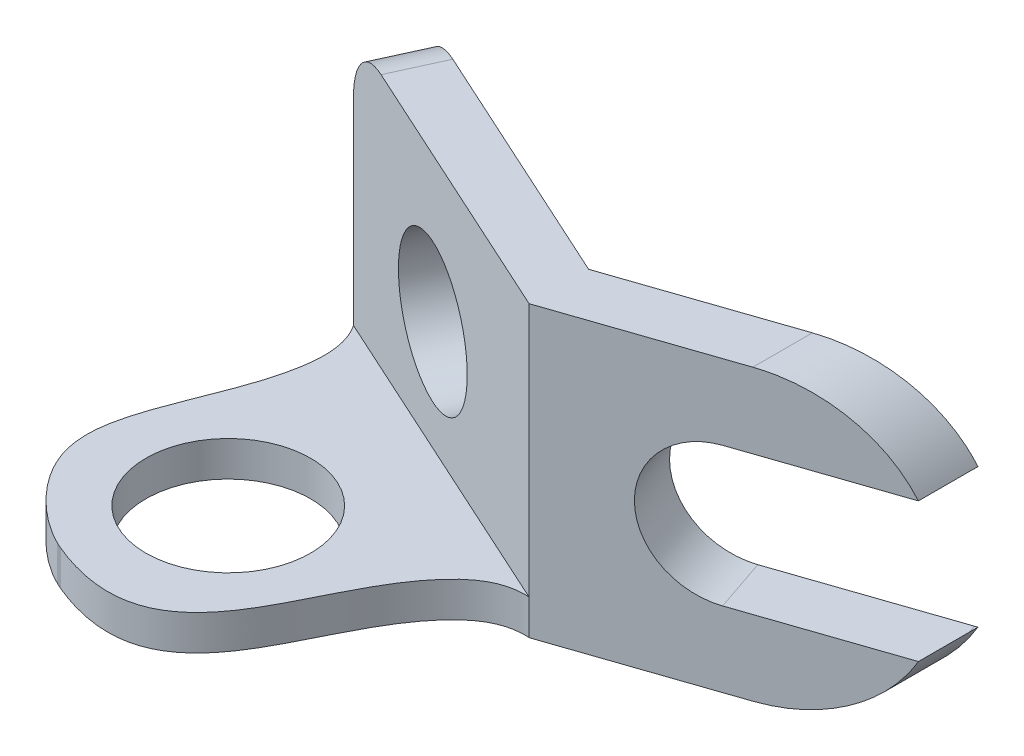
from build123d import *

# Parameters (mm, degrees)
BOSS_EXTRUDE1_DEPTH = 52
FILLET1_R           = 25
CUT_EXTRUDE1_DEPTH  = 52
FILLET2_R           = 10
SKETCH3_R           = 12.5
CUT_EXTRUDE2_DEPTH  = 52
SKETCH5_W           = 63.955413662
SKETCH5_H           = 6.318805718
BOSS_EXTRUDE2_DEPTH = 52
SKETCH6_R           = 14.796953782
CUT_EXTRUDE5_DEPTH  = 12


with BuildPart() as part:
    # Sketch1 → Boss-Extrude1 (new body)
    with BuildSketch(Plane(origin=(0, 0, 0), x_dir=(1, 0, 0), z_dir=(0, 1, 0))):
        Polygon((0, 0), (-54.007699651, 24.646064638), (-58.048980527, 15.790278249), (0, -10.699998794), (55, 8.034068022), (55, 18.734066816), align=None)
    extrude(amount=-BOSS_EXTRUDE1_DEPTH)

    # Fillet1
    fillet1_edges = [part.edges().sort_by_distance(p)[0] for p in [
        (55, -52, -13.384067419),
        (55, 0, -13.384067419),
    ]]
    fillet(fillet1_edges, radius=FILLET1_R)

    # Sketch2 → Cut-Extrude1 (cut)
    with BuildSketch(Plane(origin=(3.265731793, 0, 9.587627201), x_dir=(0.9465939078280105, 0, -0.32242824575848833), z_dir=(0.32242824575848833, 0, 0.9465939078280106))):
        with BuildLine():
            Line((54.653075389, -38.5), (23.959854488, -38.5))
            ThreePointArc((23.959854488, -38.5), (11.459854488, -26), (23.959854488, -13.5))
            Line((23.959854488, -13.5), (54.653075389, -13.5))
            ThreePointArc((54.653075389, -13.5), (67.153075389, -26), (54.653075389, -38.5))
        make_face()
    extrude(amount=-CUT_EXTRUDE1_DEPTH, mode=Mode.SUBTRACT)

    # Fillet2
    fillet2_edges = [part.edges().sort_by_distance(p)[0] for p in [
        (-56.028340089, 0, -20.218171443),
    ]]
    fillet(fillet2_edges, radius=FILLET2_R)

    # Sketch3 → Cut-Extrude2 (cut)
    with BuildSketch(Plane(origin=(-4.041280876, 0, 8.855786388), x_dir=(0.9097492407271736, 0, 0.4151581855104526), z_dir=(-0.4151581855104526, 0, 0.9097492407271736))):
        with Locations((-30.557807916, -26)):
            Circle(SKETCH3_R)
    extrude(amount=-CUT_EXTRUDE2_DEPTH, mode=Mode.SUBTRACT)

    # Sketch5 → Boss-Extrude2 (add)
    with BuildSketch(Plane(origin=(-4.041280876, 0, 8.855786388), x_dir=(0.9097492407271736, 0, 0.4151581855104526), z_dir=(-0.4151581855104526, 0, 0.9097492407271736))):
        with Locations((-27.387772395, -48.840597141)):
            Rectangle(SKETCH5_W, SKETCH5_H)
    extrude(amount=BOSS_EXTRUDE2_DEPTH)

    # Sketch6 → Cut-Extrude5 (cut)
    with BuildSketch(Plane(origin=(0, -45.681194282, 0), x_dir=(1, 0, 0), z_dir=(0, 1, 0))):
        with Locations(Location((-41.275083904, -23.507254491, 0), (0, 0, 270))):
            Circle(SKETCH6_R)
        with BuildLine():
            add(Edge.make_bspline(
                [(-58.048980527, 15.790278249), (-55.831409205, 12.43111817), (-55.468462462, -1.484994571), (-66.211863789, -17.980786489), (-64.125030252, -34.334258251), (-56.260496604, -41.858023354), (-51.107014647, -44.526823974), (-50.545511664, -44.792489014)],
                knots=[0, 0, 0, 0, 0.058811155, 0.20931912, 0.241844454, 0.351539163, 0.365251001, 0.365251001, 0.365251001, 0.365251001], degree=3))
            Line((-58.048980527, 15.790278249), (-79.637206174, -31.516682269))
            Line((-79.637206174, -31.516682269), (-50.545511664, -44.792489014))
        make_face()
        with BuildLine():
            add(Edge.make_bspline(
                [(-49.907067766, -45.08383876), (-49.177932221, -45.404712271), (-41.127943342, -48.502484641), (-33.005537612, -48.370799962), (-20.855856008, -36.685330942), (-16.080658073, -18.863651279), (-4.727836106, -10.381149917), (0, -10.699998794)],
                knots=[0.370486493, 0.370486493, 0.370486493, 0.370486493, 0.388554906, 0.574986146, 0.630925752, 0.892011359, 1, 1, 1, 1], degree=3))
            Line((-49.907067766, -45.08383876), (-21.453817154, -58.068295759))
            Line((-21.453817154, -58.068295759), (0.134408493, -10.761335241))
            Line((0.134408493, -10.761335241), (0, -10.699998794))
        make_face()
    extrude(amount=-CUT_EXTRUDE5_DEPTH, mode=Mode.SUBTRACT)


solid = part.part
